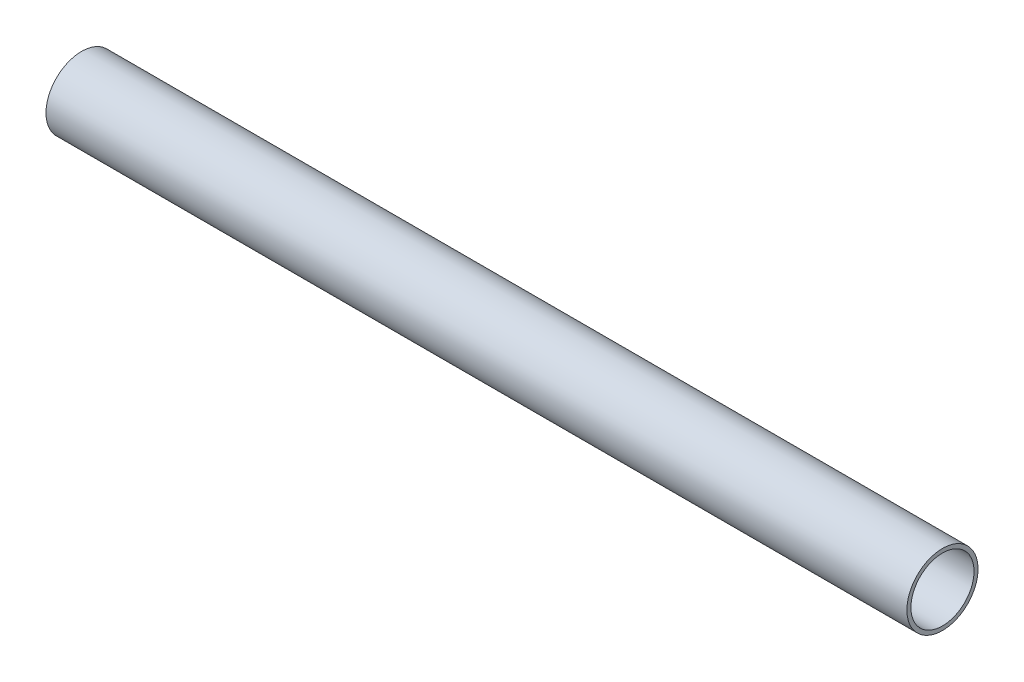
from build123d import *

# Parameters (mm, degrees)
SKETCH1_R           = 1.5748
SKETCH1_R_2         = 1.397
BOSS_EXTRUDE1_DEPTH = 38.1


with BuildPart() as part:
    # Sketch1 → Boss-Extrude1 (new body)
    with BuildSketch(Plane(origin=(0, 0, 0), x_dir=(0, 0, -1), z_dir=(1, 0, 0))):
        with Locations(Location((0, 0, 0), (0, 0, 180))):
            Circle(SKETCH1_R)
        with Locations(Location((0, 0, 0), (0, 0, 180))):
            Circle(SKETCH1_R_2, mode=Mode.SUBTRACT)
    extrude(amount=BOSS_EXTRUDE1_DEPTH)


solid = part.part
